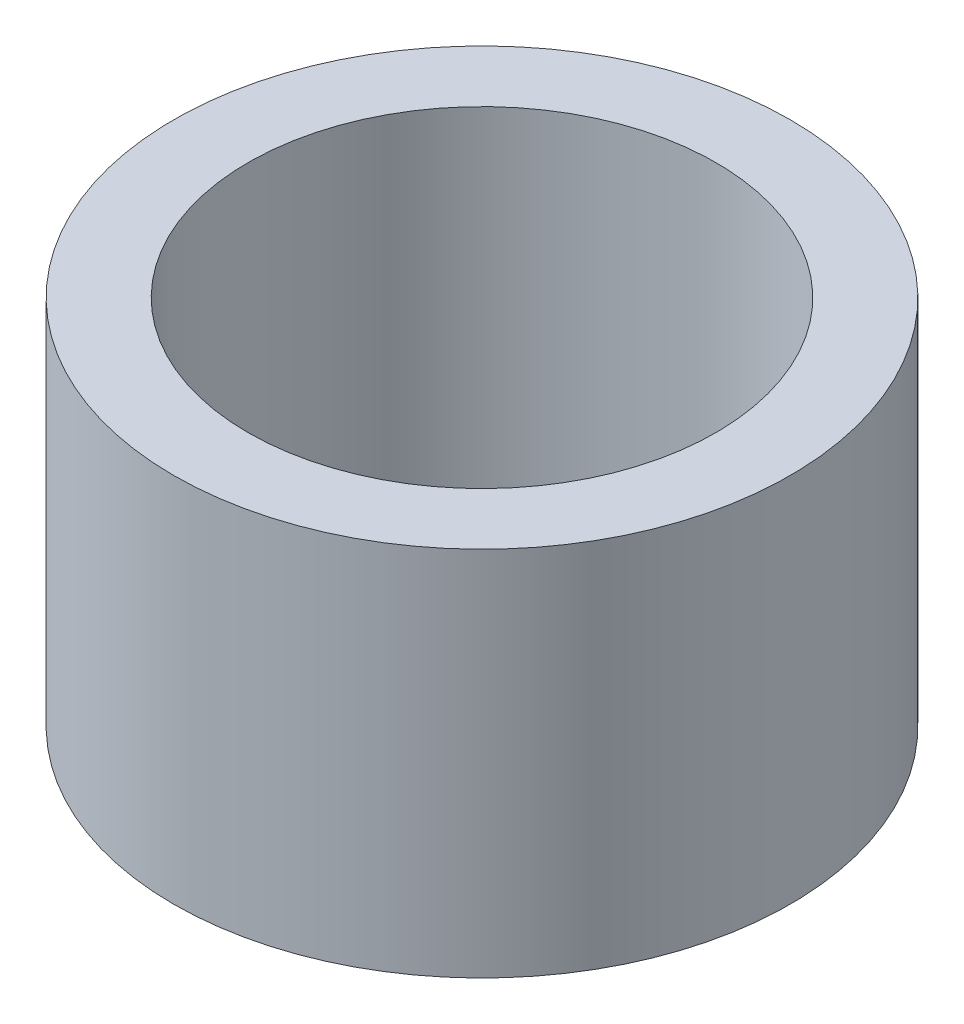
from build123d import *

# Parameters (mm, degrees)
SKETCH1_R           = 5.27
SKETCH1_R_2         = 4
BOSS_EXTRUDE1_DEPTH = 6.35


with BuildPart() as part:
    # Sketch1 → Boss-Extrude1 (new body)
    with BuildSketch(Plane(origin=(0, 0, 0), x_dir=(1, 0, 0), z_dir=(0, 1, 0))):
        with Locations(Location((0, 0, 0), (0, 0, 270))):
            Circle(SKETCH1_R)
        with Locations(Location((0, 0, 0), (0, 0, 270))):
            Circle(SKETCH1_R_2, mode=Mode.SUBTRACT)
    extrude(amount=BOSS_EXTRUDE1_DEPTH)


solid = part.part
